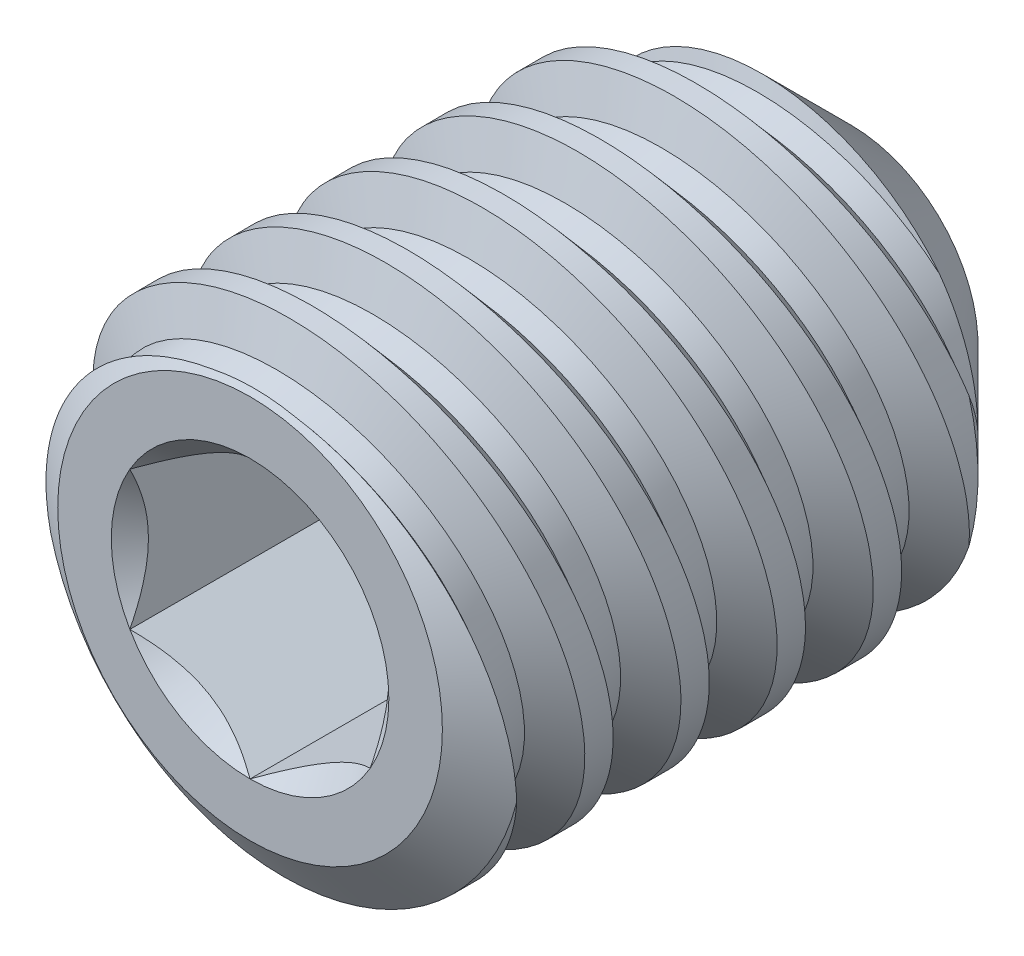
from build123d import *

# Parameters (mm, degrees)
LPATTERN1_COUNT     = 5
LPATTERN1_PITCH     = 1.27
LPATTERN1_COL_COUNT = 2
LPATTERN1_COL_PITCH = 1.27
CUT_EXTRUDE10_DEPTH = 3.175


with BuildPart() as part:
    # Sketch22 → Revolve1 (revolve)
    with BuildSketch(Plane(origin=(0, 0, 0), x_dir=(0, 0, -1), z_dir=(1, 0, 0)), mode=Mode.PRIVATE) as revolve1_sk:
        Polygon((0, 0), (0, 2.54), (0.444631787, 3.175), (6.4389, 3.175), (7.9375, 1.6764), (6.930217258, 0), align=None)
    revolve(revolve1_sk.sketch.rotate(Axis((0, 0, -6.930217258), (0, 0, -1)), 180), axis=Axis((0, 0, -6.930217258), (0, 0, -1)))

    # Sketch6 → Cut-Revolve8 (revolve, cut)
    with BuildSketch(Plane(origin=(0, 0, 0), x_dir=(0, 0, -1), z_dir=(1, 0, 0))):
        Polygon((5.431358824, 2.672175229), (5.120024459, 2.609908356), (4.596044769, 3.206133436), (5.685715045, 3.424067492), align=None)
    cut_revolve8 = revolve(axis=Axis((0, 0.272704483, -7.167422413), (0, -0.19611613513818865, 0.9805806756909193)), mode=Mode.SUBTRACT)

    # LPattern1: Cut-Revolve8 ×5
    with Locations(*[(0, 0, i * LPATTERN1_PITCH) for i in range(1, LPATTERN1_COUNT)]):
        add(cut_revolve8, mode=Mode.SUBTRACT)

    # LPattern1 col: Cut-Revolve8 ×2
    with Locations(*[(0, 0, -i * LPATTERN1_COL_PITCH) for i in range(1, LPATTERN1_COL_COUNT)]):
        add(cut_revolve8, mode=Mode.SUBTRACT)

    # Sketch23 → Cut-Extrude10 (cut)
    with BuildSketch(Plane.XY):
        Polygon((0, 1.833087105), (-1.5875, 0.916543552), (-1.5875, -0.916543552), (0, -1.833087105), (1.5875, -0.916543552), (1.5875, 0.916543552), align=None)
    extrude(amount=-CUT_EXTRUDE10_DEPTH, mode=Mode.SUBTRACT)

    # Cut-Extrude11 cone 1 section (through the dimple's axis) → Cut-Extrude11 (revolve, cut)
    with BuildSketch(Plane(origin=(0, 0, 0), x_dir=(0, -1, 0), z_dir=(1, 0, 0))):
        Polygon((0, 0), (1.833087105, 0), (0, 1.833087105), align=None)
    revolve(axis=Axis((0, 0, 0), (0, 0, -1)), mode=Mode.SUBTRACT)

    # Cut-Extrude12 cone 1 section (through the dimple's axis) → Cut-Extrude12 (revolve, cut)
    with BuildSketch(Plane(origin=(0, 0, -3.175), x_dir=(0, -1, 0), z_dir=(1, 0, 0))):
        Polygon((0, 0), (1.5875, 0), (0, 0.953866233), align=None)
    revolve(axis=Axis((0, 0, -3.175), (0, 0, -1)), mode=Mode.SUBTRACT)


solid = part.part
